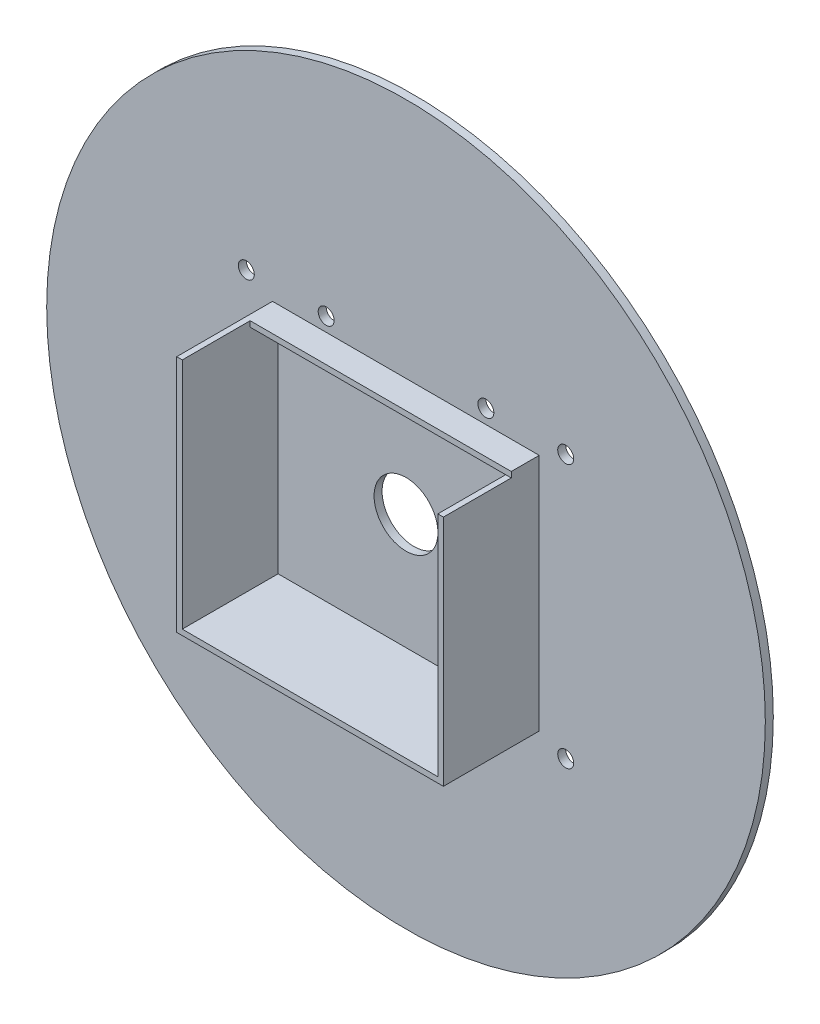
from build123d import *

# Parameters (mm, degrees)
SKETCH_1_R          = 45
EXTRUDE_1_DEPTH     = 1
SKETCH_2_R          = 1
CUT_EXTRUDE_1_DEPTH = 64.647466564
SKETCH_4_R          = 4
CUT_EXTRUDE_2_DEPTH = 64.647466564
SKETCH_5_W          = 0.7
SKETCH_5_H          = 28.5
EXTRUDE_2_DEPTH     = 12
EXTRUDE_2_2_DEPTH   = 3.5
EXTRUDE_3_DEPTH     = 12


with BuildPart() as part:
    # 草图1 → 凸台-拉伸1 (new body)
    with BuildSketch(Plane.XY):
        Circle(SKETCH_1_R)
    extrude(amount=EXTRUDE_1_DEPTH)

    # 草图2 → 切除-拉伸1 (cut, through all)
    with BuildSketch(Plane.XY.offset(1)):
        with Locations((20, -16.5)):
            Circle(SKETCH_2_R)
        with Locations((20, 16.5)):
            Circle(SKETCH_2_R)
        with Locations((-20, 16.5)):
            Circle(SKETCH_2_R)
        with Locations((-20, -16.5)):
            Circle(SKETCH_2_R)
        with Locations((10, -16.5)):
            Circle(SKETCH_2_R)
        with Locations((10, 16.5)):
            Circle(SKETCH_2_R)
        with Locations((-10, 16.5)):
            Circle(SKETCH_2_R)
        with Locations((-10, -16.5)):
            Circle(SKETCH_2_R)
    extrude(amount=-CUT_EXTRUDE_1_DEPTH, mode=Mode.SUBTRACT)

    # 草图4 → 切除-拉伸2 (cut, through all)
    with BuildSketch(Plane.XY.offset(1)):
        Circle(SKETCH_4_R)
    extrude(amount=-CUT_EXTRUDE_2_DEPTH, mode=Mode.SUBTRACT)

    # 草图5 → Extrude 2 (add)
    with BuildSketch(Plane.XY.offset(1)):
        with Locations((16.331438859, -0.213782194)):
            Rectangle(SKETCH_5_W, SKETCH_5_H)
    extrude(amount=EXTRUDE_2_DEPTH)

    # 草图9 → Extrude 2 2 (add)
    with BuildSketch(Plane.XY.offset(1)):
        Polygon((16.681438859, 14.736217806), (-16.018561141, 14.736217806), (-16.018561141, 14.036217806), (15.981438859, 14.036217806), (16.681438859, 14.036217806), align=None)
    extrude(amount=EXTRUDE_2_2_DEPTH)

    # 草图10 → 凸台-拉伸3 (add)
    with BuildSketch(Plane.XY.offset(1)):
        Polygon((16.681438859, -14.463782194), (16.681438859, -15.163782194), (-16.718561141, -15.163782194), (-16.718561141, 14.736217806), (-16.018561141, 14.736217806), (-16.018561141, -14.463782194), (15.981438859, -14.463782194), align=None)
    extrude(amount=EXTRUDE_3_DEPTH)


solid = part.part
